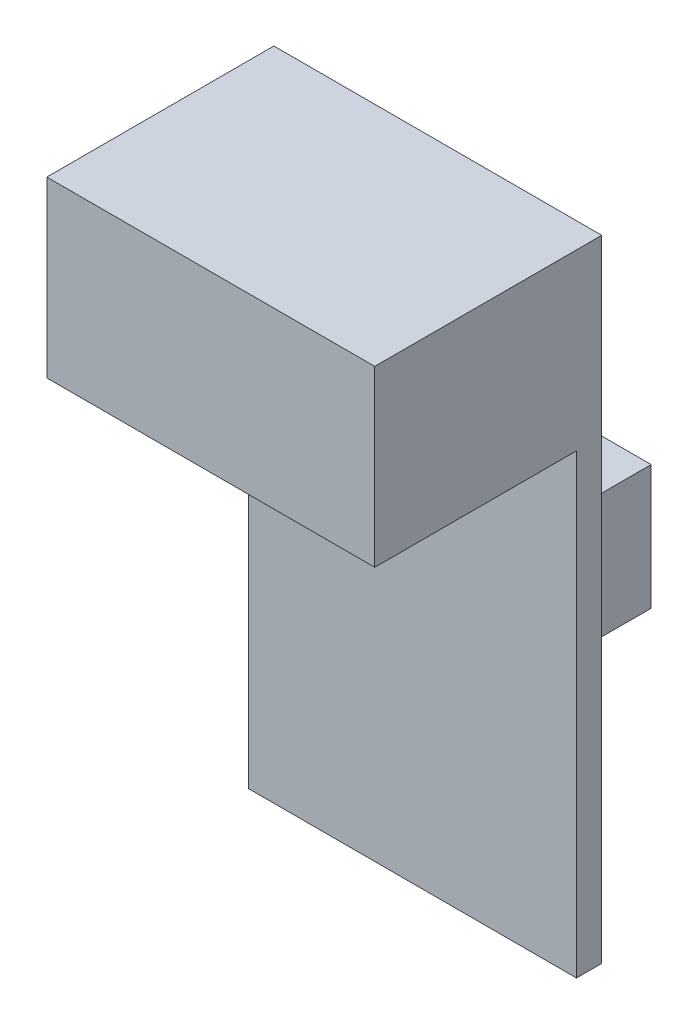
from build123d import *

# Parameters (mm, degrees)
SKETCH_1_W      = 13
SKETCH_1_H      = 25
EXTRUDE_1_DEPTH = 1
SKETCH_2_W      = 13
SKETCH_2_H      = 6.898597806
EXTRUDE_2_DEPTH = 8
SKETCH_3_R      = 0.52733121
EXTRUDE_3_DEPTH = 1
FILLET_3_R      = 0.5
FILLET_4_R      = 0.5
SKETCH_4_W      = 5.702517664
SKETCH_4_H      = 4.934093298
EXTRUDE_4_DEPTH = 3
SKETCH_5_W      = 4.286999095
SKETCH_5_H      = 5.985621379
EXTRUDE_5_DEPTH = 1.5
SKETCH_6_W      = 0.52576404
SKETCH_6_H      = 0.323547102
SKETCH_6_W_2    = 0.202216939
SKETCH_6_H_2    = 0.444877264
SKETCH_6_W_3    = 0.404433876
SKETCH_6_H_3    = 0.161773551
SKETCH_6_W_4    = 1.132414855
SKETCH_6_W_5    = 0.404433877
SKETCH_6_H_4    = 0.647094203
SKETCH_6_W_6    = 0.242660326
SKETCH_6_H_5    = 0.606650815
EXTRUDE_6_DEPTH = 0.5


with BuildPart() as part:
    # 草图1 → 凸台-拉伸1 (new body)
    with BuildSketch(Plane.XY):
        Rectangle(SKETCH_1_W, SKETCH_1_H)
    extrude(amount=EXTRUDE_1_DEPTH)

    # 草图2 → 凸台-拉伸2 (add)
    with BuildSketch(Plane.XY.offset(1)):
        with Locations((0, 9.050701097)):
            Rectangle(SKETCH_2_W, SKETCH_2_H)
    extrude(amount=EXTRUDE_2_DEPTH)

    # 草图3 → 凸台-拉伸3 (add)
    with BuildSketch(Plane(origin=(0, 0, 0), x_dir=(-1, 0, 0), z_dir=(0, 0, -1))):
        with Locations(Location((-4.86638581, 8.684245234, 0), (0, 0, 180))):
            Circle(SKETCH_3_R)
        with Locations(Location((-1.86638581, 8.684245234, 0), (0, 0, 180))):
            Circle(SKETCH_3_R)
        with Locations(Location((1.13361419, 8.684245234, 0), (0, 0, 180))):
            Circle(SKETCH_3_R)
        with Locations(Location((4.13361419, 8.684245234, 0), (0, 0, 180))):
            Circle(SKETCH_3_R)
        with Locations(Location((-1.86638581, 6.684245234, 0), (0, 0, 180))):
            Circle(SKETCH_3_R)
        with Locations(Location((1.13361419, 6.684245234, 0), (0, 0, 180))):
            Circle(SKETCH_3_R)
        with Locations(Location((4.13361419, 6.684245234, 0), (0, 0, 180))):
            Circle(SKETCH_3_R)
        with Locations(Location((-4.86638581, 6.684245234, 0), (0, 0, 180))):
            Circle(SKETCH_3_R)
    extrude(amount=EXTRUDE_3_DEPTH)

    # 圆角3
    fillet_3_edges = [part.edges().sort_by_distance(p)[0] for p in [
        (4.3390546, 8.684245234, -1),
    ]]
    fillet(fillet_3_edges, radius=FILLET_3_R)

    # 圆角4
    fillet_4_edges = [part.edges().sort_by_distance(p)[0] for p in [
        (1.3390546, 8.684245234, -1),
        (-1.6609454, 8.684245234, -1),
        (-4.6609454, 8.684245234, -1),
        (1.3390546, 6.684245234, -1),
        (-1.6609454, 6.684245234, -1),
        (-4.6609454, 6.684245234, -1),
        (4.3390546, 6.684245234, -1),
    ]]
    fillet(fillet_4_edges, radius=FILLET_4_R)

    # 草图4 → 凸台-拉伸4 (add)
    with BuildSketch(Plane(origin=(0, 0, 0), x_dir=(-1, 0, 0), z_dir=(0, 0, -1))):
        with Locations((-2.608598506, 0.141539357)):
            Rectangle(SKETCH_4_W, SKETCH_4_H)
    extrude(amount=EXTRUDE_4_DEPTH)

    # 草图5 → 凸台-拉伸5 (add)
    with BuildSketch(Plane(origin=(0, 0, 0), x_dir=(-1, 0, 0), z_dir=(0, 0, -1))):
        with Locations((3.842121831, 0.181982744)):
            Rectangle(SKETCH_5_W, SKETCH_5_H)
    extrude(amount=EXTRUDE_5_DEPTH)

    # 草图6 → 凸台-拉伸6 (add)
    with BuildSketch(Plane(origin=(0, 0, 0), x_dir=(-1, 0, 0), z_dir=(0, 0, -1))):
        with Locations((3.336579485, -4.185903126)):
            Rectangle(SKETCH_6_W, SKETCH_6_H)
        with Locations((4.671211279, -5.500313226)):
            Rectangle(SKETCH_6_W_2, SKETCH_6_H_2)
        with Locations((5.2576404, -4.266789902)):
            Rectangle(SKETCH_6_W_3, SKETCH_6_H_3)
        with Locations((1.779509058, -5.500313226)):
            Rectangle(SKETCH_6_W_4, SKETCH_6_H_2)
        with Locations((-3.882565218, -4.954327493)):
            Rectangle(SKETCH_6_W_5, SKETCH_6_H_4)
        with Locations((-1.819952446, -3.720804167)):
            Rectangle(SKETCH_6_W_6, SKETCH_6_H_5)
    extrude(amount=EXTRUDE_6_DEPTH)


solid = part.part
